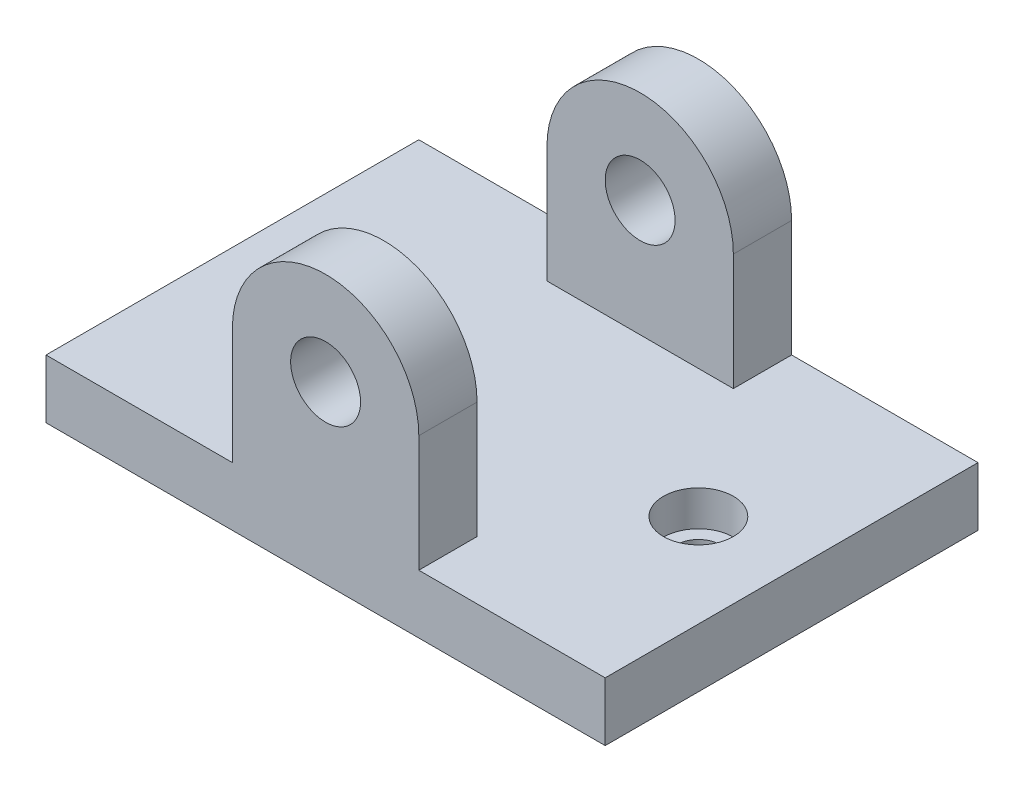
from build123d import *

# Parameters (mm, degrees)
SKETCH1_W                                           = 152.4
SKETCH1_H                                           = 101.6
BOSS_EXTRUDE1_DEPTH                                 = 16.002
CBORE_FOR_0_BINDING_HEAD_MACHINE_SCREW1_D           = 11.9126
CBORE_FOR_0_BINDING_HEAD_MACHINE_SCREW1_CBORE_D     = 19.05
CBORE_FOR_0_BINDING_HEAD_MACHINE_SCREW1_CBORE_DEPTH = 9.652
BOSS_EXTRUDE2_DEPTH                                 = 15.875
SKETCH8_R                                           = 9.525
CUT_EXTRUDE1_DEPTH                                  = 147.561301523


with BuildPart() as part:
    # Sketch1 → Boss-Extrude1 (new body)
    with BuildSketch(Plane(origin=(0, 0, 0), x_dir=(1, 0, 0), z_dir=(0, 1, 0))):
        Rectangle(SKETCH1_W, SKETCH1_H)
    extrude(amount=BOSS_EXTRUDE1_DEPTH)

    # CBORE for #0 Binding Head Machine Screw1 (through all)
    with Locations(Plane(origin=(0, 16.002, 0), x_dir=(1, 0, 0), z_dir=(0, 1, 0))):
        with Locations((-50.8, 0), (50.8, 0)):
            CounterBoreHole(CBORE_FOR_0_BINDING_HEAD_MACHINE_SCREW1_D / 2, CBORE_FOR_0_BINDING_HEAD_MACHINE_SCREW1_CBORE_D / 2, CBORE_FOR_0_BINDING_HEAD_MACHINE_SCREW1_CBORE_DEPTH)

    # Sketch7 → Boss-Extrude2 (add)
    with BuildSketch(Plane.XY.offset(50.8)):
        with BuildLine():
            Line((-25.4, 16.002), (-25.4, 47.752))
            ThreePointArc((-25.4, 47.752), (0, 73.152), (25.4, 47.752))
            Line((25.4, 47.752), (25.4, 16.002))
            Line((25.4, 16.002), (-25.4, 16.002))
        make_face()
    boss_extrude2 = extrude(amount=-BOSS_EXTRUDE2_DEPTH)

    # Mirror1: Boss-Extrude2 across plane
    add(boss_extrude2.mirror(Plane.XY))

    # Sketch8 → Cut-Extrude1 (cut, through all)
    with BuildSketch(Plane.XY.offset(50.8)):
        with Locations((0, 47.752)):
            Circle(SKETCH8_R)
    extrude(amount=-CUT_EXTRUDE1_DEPTH, mode=Mode.SUBTRACT)


solid = part.part
